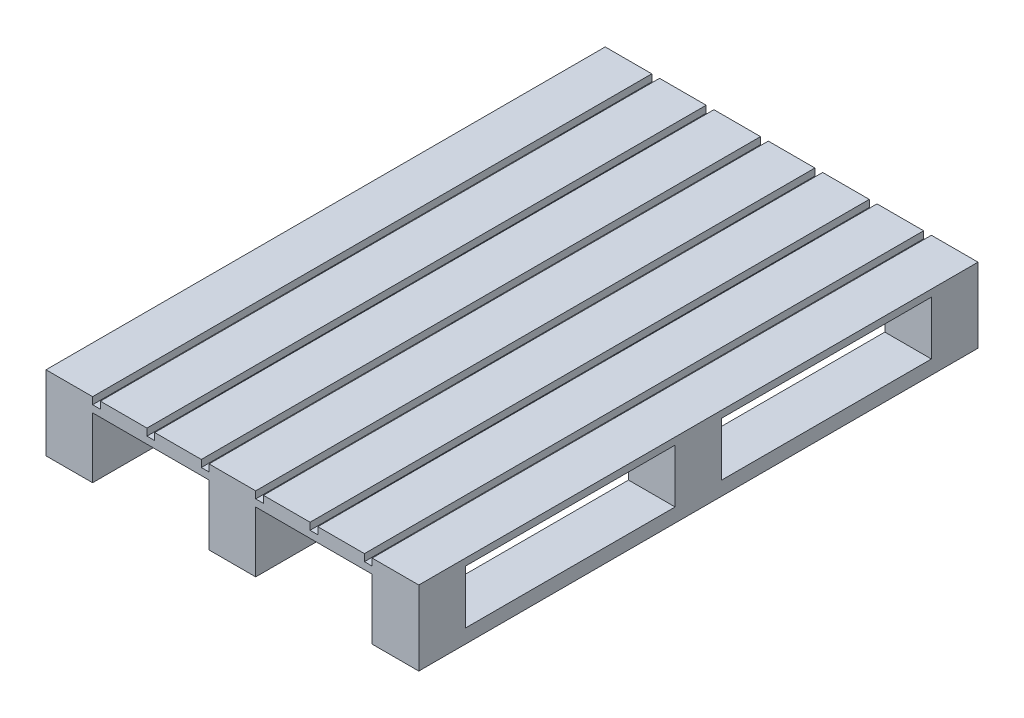
from build123d import *

# Parameters (mm, degrees)
SKETCH1_W           = 800
SKETCH1_H           = 1200
BOSS_EXTRUDE1_DEPTH = 160
SKETCH2_W           = 250
SKETCH2_H           = 130
CUT_EXTRUDE1_DEPTH  = 1452.068571777
SKETCH3_W           = 450
SKETCH3_H           = 115
CUT_EXTRUDE2_DEPTH  = 1452.068571777
SKETCH4_W           = 16.666666667
SKETCH4_H           = 15
SKETCH4_W_2         = 16.666666666
CUT_EXTRUDE3_DEPTH  = 1452.068571777


with BuildPart() as part:
    # Sketch1 → Boss-Extrude1 (new body)
    with BuildSketch(Plane(origin=(0, 0, 0), x_dir=(1, 0, 0), z_dir=(0, 1, 0))):
        with Locations((400, 600)):
            Rectangle(SKETCH1_W, SKETCH1_H)
    extrude(amount=BOSS_EXTRUDE1_DEPTH)

    # Sketch2 → Cut-Extrude1 (cut, through all)
    with BuildSketch(Plane.XY):
        with Locations((225, 65)):
            Rectangle(SKETCH2_W, SKETCH2_H)
        with Locations((575, 65)):
            Rectangle(SKETCH2_W, SKETCH2_H)
    extrude(amount=-CUT_EXTRUDE1_DEPTH, mode=Mode.SUBTRACT)

    # Sketch3 → Cut-Extrude2 (cut, through all)
    with BuildSketch(Plane.ZY):
        with Locations((-875, 87.5)):
            Rectangle(SKETCH3_W, SKETCH3_H)
        with Locations((-325, 87.5)):
            Rectangle(SKETCH3_W, SKETCH3_H)
    extrude(amount=-CUT_EXTRUDE2_DEPTH, mode=Mode.SUBTRACT)

    # Sketch4 → Cut-Extrude3 (cut, through all)
    with BuildSketch(Plane.XY):
        with Locations((108.333333334, 152.5)):
            Rectangle(SKETCH4_W, SKETCH4_H)
        with Locations((225, 152.5)):
            Rectangle(SKETCH4_W_2, SKETCH4_H)
        with Locations((341.666666667, 152.5)):
            Rectangle(SKETCH4_W, SKETCH4_H)
        with Locations((458.333333334, 152.5)):
            Rectangle(SKETCH4_W, SKETCH4_H)
        with Locations((575, 152.5)):
            Rectangle(SKETCH4_W_2, SKETCH4_H)
        with Locations((691.666666667, 152.5)):
            Rectangle(SKETCH4_W, SKETCH4_H)
    extrude(amount=-CUT_EXTRUDE3_DEPTH, mode=Mode.SUBTRACT)


solid = part.part
